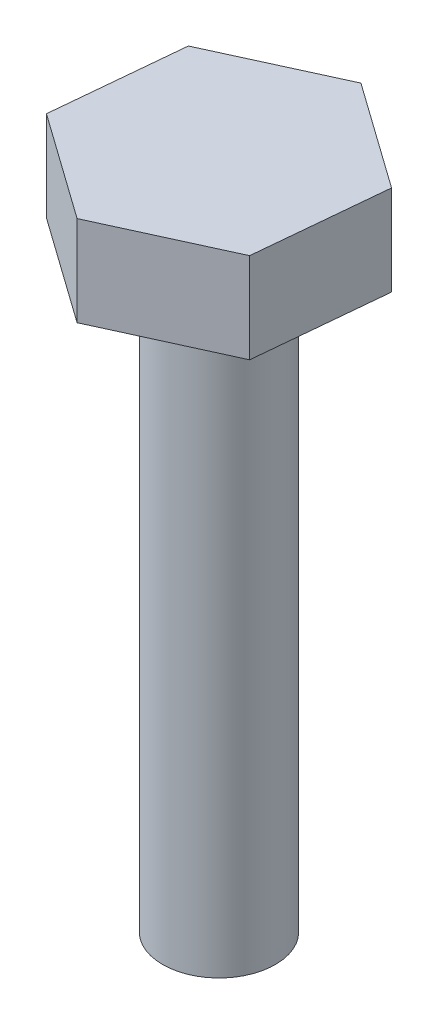
from build123d import *

# Parameters (mm, degrees)
SKETCH1_R           = 0.125
BOSS_EXTRUDE2_DEPTH = 1.3
BOSS_EXTRUDE3_DEPTH = 0.2


with BuildPart() as part:
    # Sketch1 → Boss-Extrude2 (new body)
    with BuildSketch(Plane(origin=(0, 0, 0), x_dir=(1, 0, 0), z_dir=(0, 1, 0))):
        with Locations(Location((0, 0, 0), (0, 0, 270))):
            Circle(SKETCH1_R)
    extrude(amount=BOSS_EXTRUDE2_DEPTH)

    # Sketch3 → Boss-Extrude3 (add)
    with BuildSketch(Plane(origin=(0, 1.3, 0), x_dir=(1, 0, 0), z_dir=(0, 1, 0))):
        Polygon((0.235249829, -0.167304667), (0.262515006, 0.120079994), (0.027265177, 0.287384661), (-0.235249829, 0.167304667), (-0.262515006, -0.120079994), (-0.027265177, -0.287384661), align=None)
    extrude(amount=BOSS_EXTRUDE3_DEPTH)


solid = part.part
